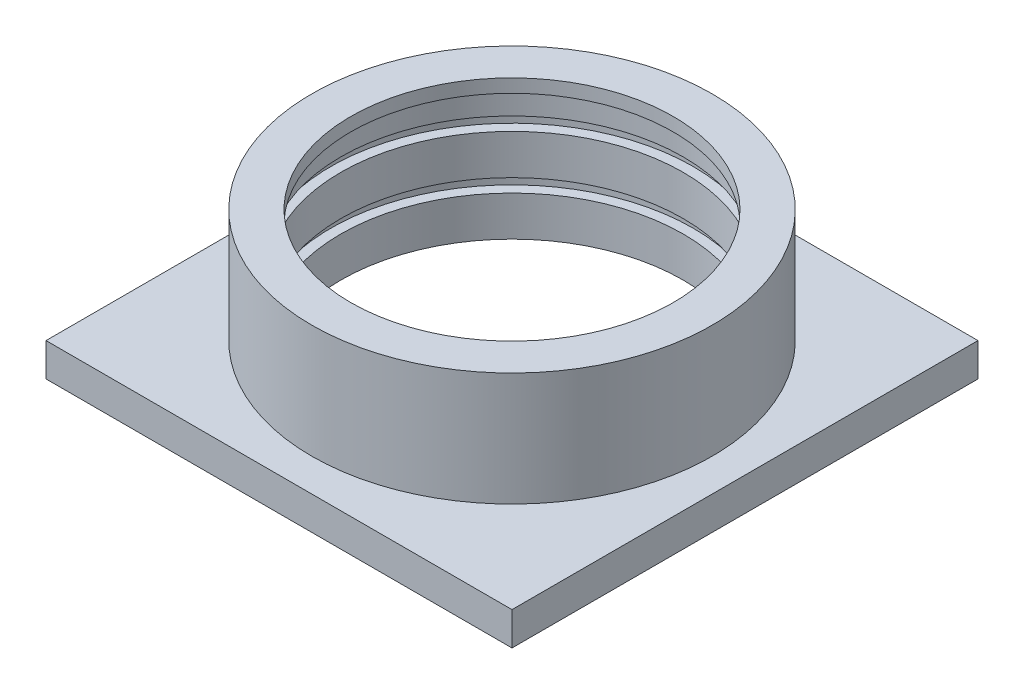
from build123d import *

# Parameters (mm, degrees)
SKETCH1_W           = 69.8
SKETCH1_H           = 69.8
BOSS_EXTRUDE1_DEPTH = 4.98
SKETCH2_R           = 30
BOSS_EXTRUDE2_DEPTH = 17
SKETCH3_R           = 25.65
CUT_EXTRUDE1_DEPTH  = 19.98
SKETCH4_R           = 24.15
CUT_EXTRUDE3_DEPTH  = 2
CUT_EXTRUDE4_START  = -6
SKETCH5_R           = 27.15
CUT_EXTRUDE4_DEPTH  = 2
CUT_EXTRUDE5_START  = -14
SKETCH5_2_R         = 27.15
CUT_EXTRUDE5_DEPTH  = 2


with BuildPart() as part:
    # Sketch1 → Boss-Extrude1 (new body)
    with BuildSketch(Plane(origin=(0, 0, 0), x_dir=(1, 0, 0), z_dir=(0, 1, 0))):
        Rectangle(SKETCH1_W, SKETCH1_H)
    extrude(amount=-BOSS_EXTRUDE1_DEPTH)

    # Sketch2 → Boss-Extrude2 (add)
    with BuildSketch(Plane(origin=(0, 0, 0), x_dir=(1, 0, 0), z_dir=(0, 1, 0))):
        Circle(SKETCH2_R)
    extrude(amount=BOSS_EXTRUDE2_DEPTH)

    # Sketch3 → Cut-Extrude1 (cut)
    with BuildSketch(Plane.XZ.offset(4.98)):
        Circle(SKETCH3_R)
    extrude(amount=-CUT_EXTRUDE1_DEPTH, mode=Mode.SUBTRACT)

    # Sketch4 → Cut-Extrude3 (cut)
    with BuildSketch(Plane(origin=(0, 17, 0), x_dir=(1, 0, 0), z_dir=(0, 1, 0))):
        Circle(SKETCH4_R)
    extrude(amount=-CUT_EXTRUDE3_DEPTH, mode=Mode.SUBTRACT)

    # Sketch5 → Cut-Extrude4 (cut)
    with BuildSketch(Plane(origin=(0, 17, 0), x_dir=(1, 0, 0), z_dir=(0, 1, 0)).offset(CUT_EXTRUDE4_START)):
        Circle(SKETCH5_R)
    extrude(amount=-CUT_EXTRUDE4_DEPTH, mode=Mode.SUBTRACT)

    # Sketch5<2> → Cut-Extrude5 (cut)
    with BuildSketch(Plane(origin=(0, 17, 0), x_dir=(1, 0, 0), z_dir=(0, 1, 0)).offset(CUT_EXTRUDE5_START)):
        Circle(SKETCH5_2_R)
    extrude(amount=-CUT_EXTRUDE5_DEPTH, mode=Mode.SUBTRACT)


solid = part.part
